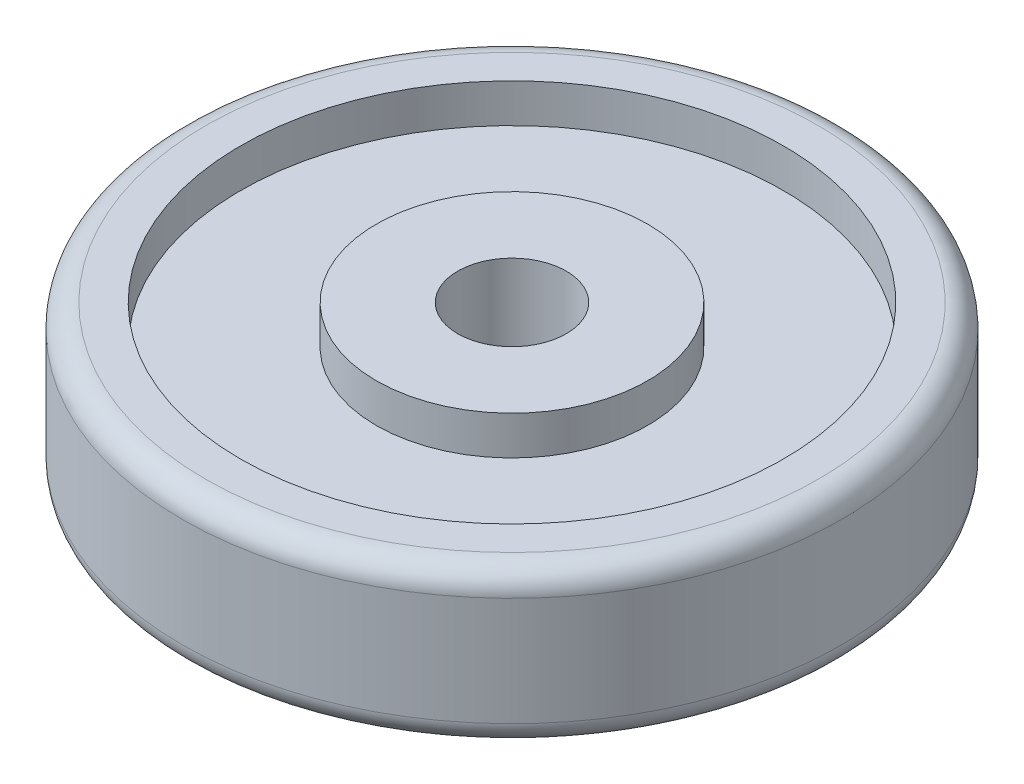
from build123d import *

# Parameters (mm, degrees)
SKETCH_1_R          = 42.5
SKETCH_1_R_2        = 7
EXTRUDE_1_DEPTH     = 20
SKETCH_2_R          = 35
SKETCH_2_R_2        = 17.5
CUT_EXTRUDE_1_DEPTH = 5
CUT_EXTRUDE_START   = -5
SKETCH_3_R          = 35
SKETCH_3_R_2        = 17.5
CUT_EXTRUDE_2_DEPTH = 5
FILLET_1_R          = 3


with BuildPart() as part:
    # 草图1 → 凸台-拉伸1 (new body)
    with BuildSketch(Plane(origin=(0, 0, 0), x_dir=(1, 0, 0), z_dir=(0, 1, 0))):
        with Locations(Location((0, 0, 0), (0, 0, 270))):
            Circle(SKETCH_1_R)
        with Locations(Location((0, 0, 0), (0, 0, 270))):
            Circle(SKETCH_1_R_2, mode=Mode.SUBTRACT)
    extrude(amount=EXTRUDE_1_DEPTH)

    # 草图2 → 切除-拉伸1 (cut)
    with BuildSketch(Plane(origin=(0, 20, 0), x_dir=(1, 0, 0), z_dir=(0, 1, 0))):
        with Locations(Location((0, 0, 0), (0, 0, 270))):
            Circle(SKETCH_2_R)
        with Locations(Location((0, 0, 0), (0, 0, 270))):
            Circle(SKETCH_2_R_2, mode=Mode.SUBTRACT)
    extrude(amount=-CUT_EXTRUDE_1_DEPTH, mode=Mode.SUBTRACT)

    # 草图3 → 切除-拉伸2 (cut)
    with BuildSketch(Plane.XZ.offset(CUT_EXTRUDE_START)):
        with Locations(Location((0, 0, 0), (0, 0, 90))):
            Circle(SKETCH_3_R)
        with Locations(Location((0, 0, 0), (0, 0, 90))):
            Circle(SKETCH_3_R_2, mode=Mode.SUBTRACT)
    extrude(amount=CUT_EXTRUDE_2_DEPTH, mode=Mode.SUBTRACT)

    # 圆角1
    fillet_1_edges = [part.edges().sort_by_distance(p)[0] for p in [
        (0, 0, -42.5),
        (0, 20, -42.5),
    ]]
    fillet(fillet_1_edges, radius=FILLET_1_R)


solid = part.part
